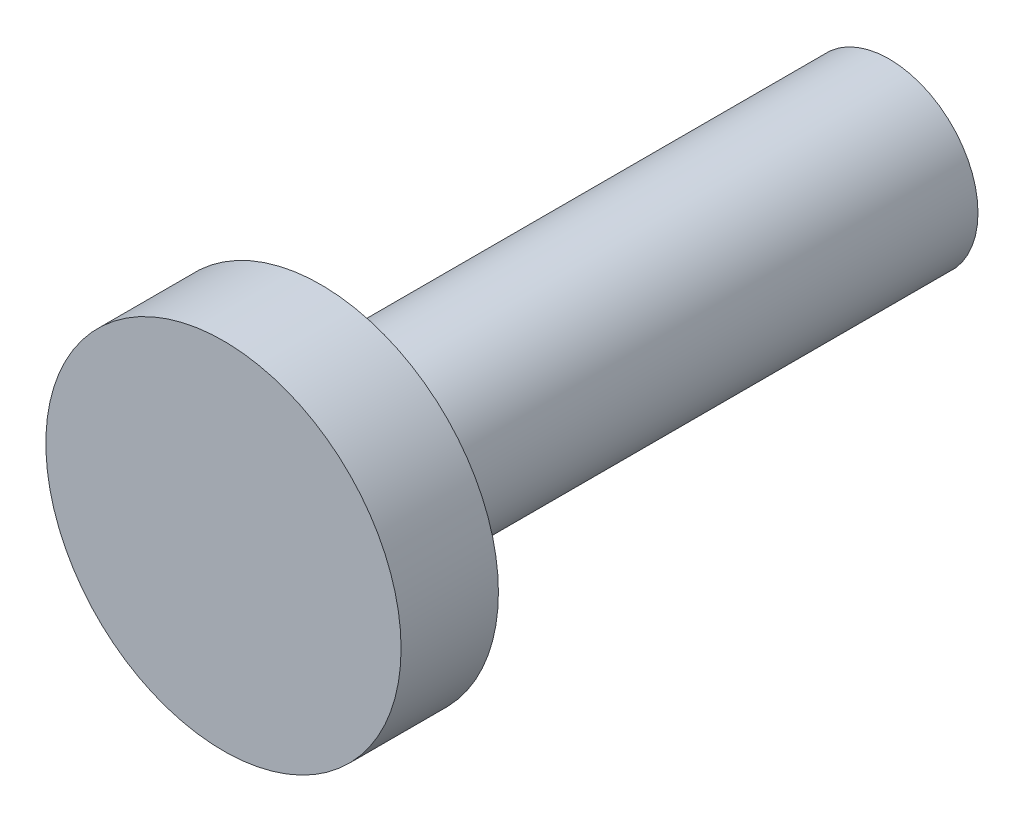
from build123d import *

# Parameters (mm, degrees)
ESQUISSE1_R        = 2.5
BOSS_EXTRU_1_DEPTH = 1.37
ESQUISSE2_R        = 1.25
BOSS_EXTRU_2_DEPTH = 8


with BuildPart() as part:
    # Esquisse1 → Boss.-Extru.1 (new body)
    with BuildSketch(Plane.XY):
        Circle(ESQUISSE1_R)
    extrude(amount=BOSS_EXTRU_1_DEPTH)

    # Esquisse2 → Boss.-Extru.2 (add)
    with BuildSketch(Plane(origin=(0, 0, 0), x_dir=(-1, 0, 0), z_dir=(0, 0, -1))):
        Circle(ESQUISSE2_R)
    extrude(amount=BOSS_EXTRU_2_DEPTH)


solid = part.part
